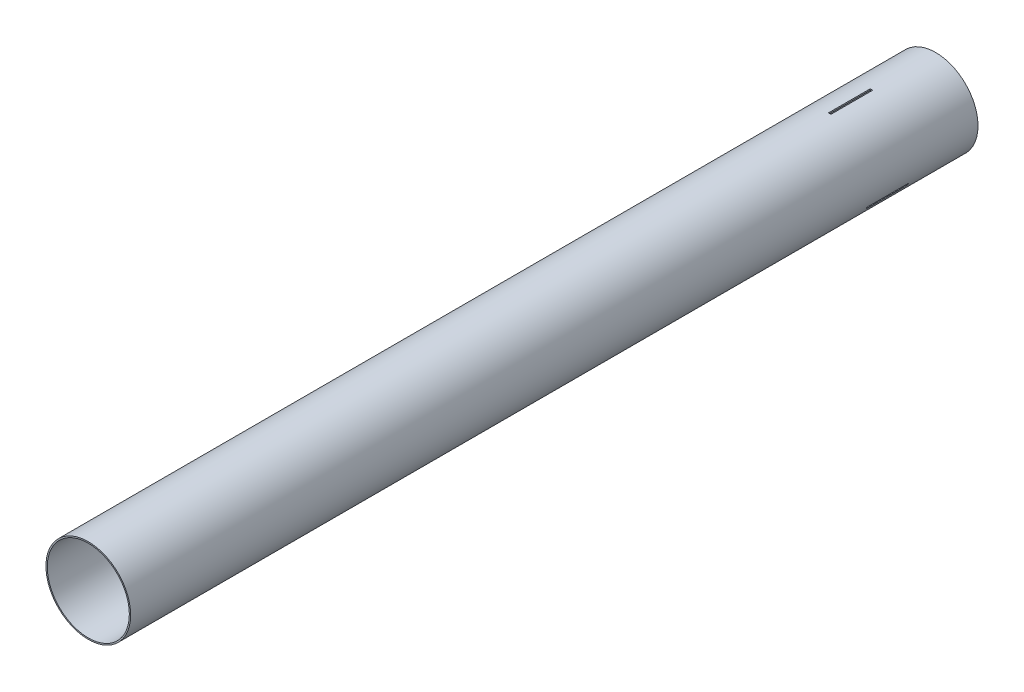
from build123d import *

# Parameters (mm, degrees)
SKETCH1_R           = 50.8
SKETCH1_R_2         = 49.2125
BOSS_EXTRUDE1_DEPTH = 1016
CUT_EXTRUDE1_START  = 127
SKETCH2_W           = 2.9972
SKETCH2_H           = 38.1
CUT_EXTRUDE1_DEPTH  = 50.0126


with BuildPart() as part:
    # Sketch1 → Boss-Extrude1 (new body)
    with BuildSketch(Plane.XY):
        Circle(SKETCH1_R)
        Circle(SKETCH1_R_2, mode=Mode.SUBTRACT)
    extrude(amount=BOSS_EXTRUDE1_DEPTH)

    # Sketch2 → Cut-Extrude1 (cut)
    with BuildSketch(Plane.XY.offset(CUT_EXTRUDE1_START)):
        Polygon((25.020238518, -16.17587567), (26.518838518, -13.58022433), (59.514406402, -32.63022433), (58.015806402, -35.22587567), align=None)
        with Locations((0, 49.2125)):
            Rectangle(SKETCH2_W, SKETCH2_H)
        Polygon((-26.870791242, -13.37702433), (-25.372191242, -15.97267567), (-58.367759126, -35.02267567), (-59.866359126, -32.42702433), align=None)
    extrude(amount=-CUT_EXTRUDE1_DEPTH, mode=Mode.SUBTRACT)


solid = part.part
